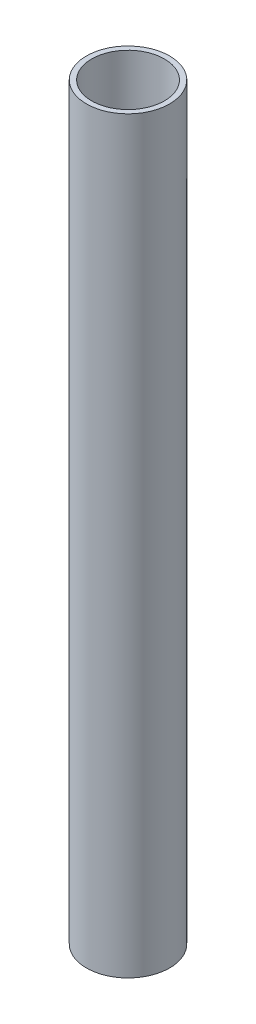
from build123d import *

# Parameters (mm, degrees)
SKETCH1_R           = 25.4
SKETCH1_R_2         = 22.225
BOSS_EXTRUDE1_DEPTH = 457.2


with BuildPart() as part:
    # Sketch1 → Boss-Extrude1 (new body)
    with BuildSketch(Plane(origin=(0, 0, 0), x_dir=(1, 0, 0), z_dir=(0, 1, 0))):
        with Locations(Location((0, 0, 0), (0, 0, 90))):
            Circle(SKETCH1_R)
        with Locations(Location((0, 0, 0), (0, 0, 90))):
            Circle(SKETCH1_R_2, mode=Mode.SUBTRACT)
    extrude(amount=BOSS_EXTRUDE1_DEPTH)


solid = part.part
